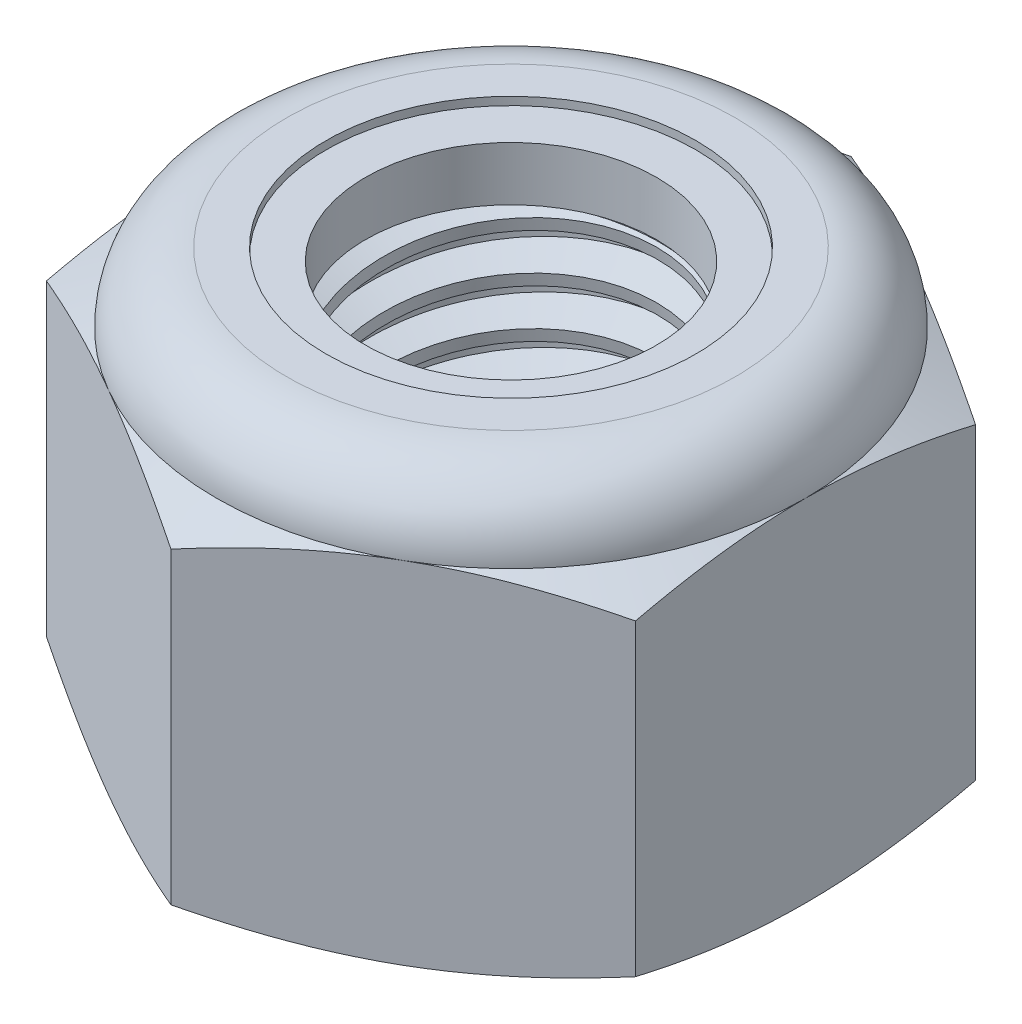
from build123d import *

# Parameters (mm, degrees)
EXTRUDE1_DEPTH      = 7.9375
SKETCH2_W           = 3.175
SKETCH2_H           = 7.9375
LPATTERN1_COUNT     = 9
LPATTERN1_PITCH     = 0.907142857
LPATTERN1_COL_COUNT = 2
LPATTERN1_COL_PITCH = 0.907142857


with BuildPart() as part:
    # Sketch1 → Extrude1 (new body)
    with BuildSketch(Plane(origin=(0, 0, 0), x_dir=(1, 0, 0), z_dir=(0, 1, 0))):
        Polygon((0, 6.415804866), (-5.55625, 3.207902433), (-5.55625, -3.207902433), (0, -6.415804866), (5.55625, -3.207902433), (5.55625, 3.207902433), align=None)
    extrude(amount=EXTRUDE1_DEPTH)

    # Sketch4 → Cut-Revolve2 (revolve, cut)
    with BuildSketch(Plane(origin=(0, 0, 0), x_dir=(0, 0, -1), z_dir=(1, 0, 0)), mode=Mode.PRIVATE) as cut_revolve2_sk:
        Polygon((0, 7.9375), (3.175, 7.9375), (2.74505598, 7.737013811), (2.74505598, 0.200486189), (3.175, 0), (0, 0), align=None)
    revolve(cut_revolve2_sk.sketch.rotate(Axis((0, 7.9375, 0), (0, 1, 0)), 54.939743186), axis=Axis((0, 7.9375, 0), (0, 1, 0)), mode=Mode.SUBTRACT)


with BuildPart() as body_2:
    # Sketch2 → Revolve1 (revolve)
    with BuildSketch(Plane(origin=(0, 0, 0), x_dir=(0, 0, -1), z_dir=(1, 0, 0))):
        with Locations((1.5875, 3.96875)):
            Rectangle(SKETCH2_W, SKETCH2_H)
    revolve(axis=Axis((0, -3.175, 0), (0, 1, 0)))

    # Sketch3 → Cut-Revolve1 (revolve, cut)
    with BuildSketch(Plane(origin=(0, 0, 0), x_dir=(0, 0, -1), z_dir=(1, 0, 0)), mode=Mode.PRIVATE) as cut_revolve1_sk:
        Polygon((3.191036172, 7.825246798), (3.303289373, 7.039474388), (2.777128323, 7.250668732), (2.74505598, 7.475175135), align=None)
    cut_revolve1 = revolve(cut_revolve1_sk.sketch.rotate(Axis((0, 7.9375, 0.1384314), (0, -0.9899494936611665, -0.14142135623731)), 180), axis=Axis((0, 7.9375, 0.1384314), (0, -0.9899494936611665, -0.14142135623731)), mode=Mode.SUBTRACT)

    # LPattern1: Cut-Revolve1 ×9
    with Locations(*[(0, -i * LPATTERN1_PITCH, 0) for i in range(1, LPATTERN1_COUNT)]):
        add(cut_revolve1, mode=Mode.SUBTRACT)

    # LPattern1 col: Cut-Revolve1 ×2
    with Locations(*[(0, i * LPATTERN1_COL_PITCH, 0) for i in range(1, LPATTERN1_COL_COUNT)]):
        add(cut_revolve1, mode=Mode.SUBTRACT)


with BuildPart() as part_1:
    add(part.part)

    # Combine1: cut body 2
    add(body_2.part, mode=Mode.SUBTRACT)

    # Sketch5 → Cut-Revolve3 (revolve, cut)
    with BuildSketch(Plane(origin=(0, 0, 0), x_dir=(0, 0, -1), z_dir=(1, 0, 0)), mode=Mode.PRIVATE) as cut_revolve3_sk:
        with BuildLine():
            Line((0, 0), (5.55625, 0))
            Line((5.55625, 0), (6.415804866, 0.400817017))
            Line((6.415804866, 0.400817017), (6.415804866, 6.213766317))
            Line((6.415804866, 6.213766317), (5.55625, 6.614583333))
            ThreePointArc((5.55625, 6.614583333), (5.168776679, 7.550026679), (4.233333333, 7.9375))
            Line((4.233333333, 7.9375), (4.233333333, 9.2075))
            Line((4.233333333, 9.2075), (7.685804866, 9.2075))
            Line((7.685804866, 9.2075), (7.685804866, -1.27))
            Line((7.685804866, -1.27), (0, -1.27))
            Line((0, -1.27), (0, 0))
        make_face()
    revolve(cut_revolve3_sk.sketch.rotate(Axis((0, 0, 0), (0, 1, 0)), 54.939743186), axis=Axis((0, 0, 0), (0, 1, 0)), mode=Mode.SUBTRACT)

    # Sketch6 → Cut-Revolve4 (revolve, cut)
    with BuildSketch(Plane(origin=(0, 0, 0), x_dir=(0, 0, -1), z_dir=(1, 0, 0)), mode=Mode.PRIVATE) as cut_revolve4_sk:
        with BuildLine():
            Line((0, 6.614583333), (5.40385, 6.614583333))
            ThreePointArc((5.40385, 6.614583333), (5.061013606, 7.442263606), (4.233333333, 7.7851))
            Line((4.233333333, 7.7851), (3.489194657, 7.7851))
            Line((3.489194657, 7.7851), (3.489194657, 9.2075))
            Line((3.489194657, 9.2075), (0, 9.2075))
            Line((0, 9.2075), (0, 6.614583333))
        make_face()
    revolve(cut_revolve4_sk.sketch.rotate(Axis((0, 9.2075, 0), (0, 1, 0)), 54.939743186), axis=Axis((0, 9.2075, 0), (0, 1, 0)), mode=Mode.SUBTRACT)


with BuildPart() as body_2_2:
    # Sketch7 → Revolve2 (revolve)
    with BuildSketch(Plane(origin=(0, 0, 0), x_dir=(0, 0, -1), z_dir=(1, 0, 0)), mode=Mode.PRIVATE) as revolve2_sk:
        with BuildLine():
            Line((2.74505598, 6.690783333), (5.324993778, 6.690783333))
            ThreePointArc((5.324993778, 6.690783333), (4.979705237, 7.4148695), (4.233333333, 7.7089))
            Line((4.233333333, 7.7089), (2.74505598, 7.7089))
            Line((2.74505598, 7.7089), (2.74505598, 6.690783333))
        make_face()
    revolve(revolve2_sk.sketch.rotate(Axis((0, 6.690783333, 0), (0, 1, 0)), 54.939743186), axis=Axis((0, 6.690783333, 0), (0, 1, 0)))


solid = Compound([part_1.part, body_2_2.part])
